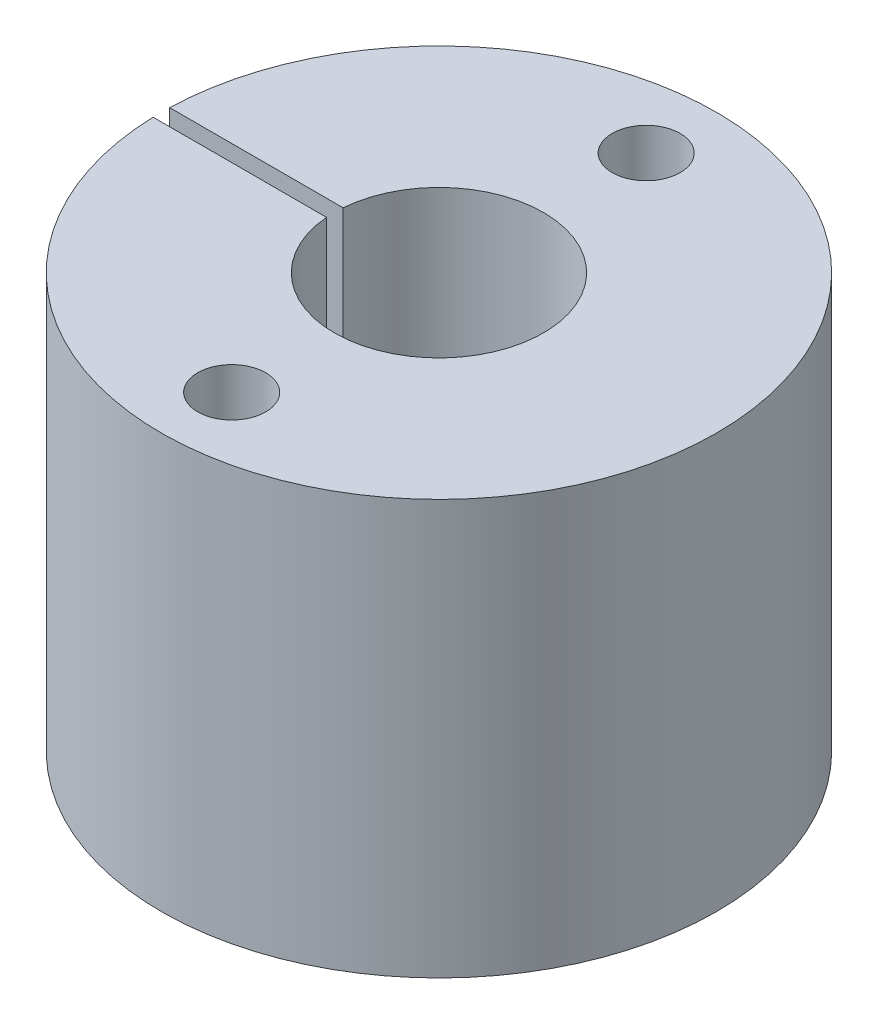
from build123d import *

# Parameters (mm, degrees)
BOSS_EXTRUDE2_DEPTH = 50
CUT_EXTRUDE1_REACH  = 70.88
SKETCH3_R           = 4.1
CUT_EXTRUDE2_DEPTH  = 30


with BuildPart() as part:
    # Sketch2 → Boss-Extrude2 (new body)
    with BuildSketch(Plane(origin=(0, 0, 0), x_dir=(1, 0, 0), z_dir=(0, 1, 0))):
        with BuildLine():
            ThreePointArc((12.6, 0), (0.500394765, -12.590059773), (-12.560254774, -1))
            Line((-12.560254774, -1), (-33.485071301, -1))
            ThreePointArc((-33.485071301, -1), (0.500055713, -33.496267617), (33.5, 0))
            ThreePointArc((33.5, 0), (0.500055713, 33.496267617), (-33.485071301, 1))
            Line((-33.485071301, 1), (-12.560254774, 1))
            ThreePointArc((-12.560254774, 1), (0.500394765, 12.590059773), (12.6, 0))
        make_face()
    extrude(amount=BOSS_EXTRUDE2_DEPTH)

    # Sketch3 → Cut-Extrude1 (cut, up to next)
    with BuildSketch(Plane.XZ, mode=Mode.PRIVATE) as cut_extrude1_sk1:
        with Locations(Location((0, 25, 0), (0, 0, 270))):
            Circle(SKETCH3_R)
    cut_extrude1_tool1 = extrude(cut_extrude1_sk1.sketch, amount=-CUT_EXTRUDE1_REACH, mode=Mode.PRIVATE) & part.part
    # Sketch3 → Cut-Extrude1 (cut, up to next)
    with BuildSketch(Plane.XZ, mode=Mode.PRIVATE) as cut_extrude1_sk2:
        with Locations(Location((0, -25, 0), (0, 0, 270))):
            Circle(SKETCH3_R)
    cut_extrude1_tool2 = extrude(cut_extrude1_sk2.sketch, amount=-CUT_EXTRUDE1_REACH, mode=Mode.PRIVATE) & part.part
    add(cut_extrude1_tool1.solids().sort_by_distance((0, 0, 25))[0], mode=Mode.SUBTRACT)
    add(cut_extrude1_tool2.solids().sort_by_distance((0, 0, -25))[0], mode=Mode.SUBTRACT)

    # Sketch8 → Cut-Extrude2 (cut)
    with BuildSketch(Plane.XZ):
        Polygon((6.618426782, 21.22158407), (6.581417572, 28.842517761), (-0.03700921, 32.620933691), (-6.618426782, 28.77841593), (-6.581417572, 21.157482239), (0.03700921, 17.379066309), align=None)
        Polygon((6.618426782, -28.77841593), (6.581417572, -21.157482239), (-0.03700921, -17.379066309), (-6.618426782, -21.22158407), (-6.581417572, -28.842517761), (0.03700921, -32.620933691), align=None)
    extrude(amount=-CUT_EXTRUDE2_DEPTH, mode=Mode.SUBTRACT)


solid = part.part
